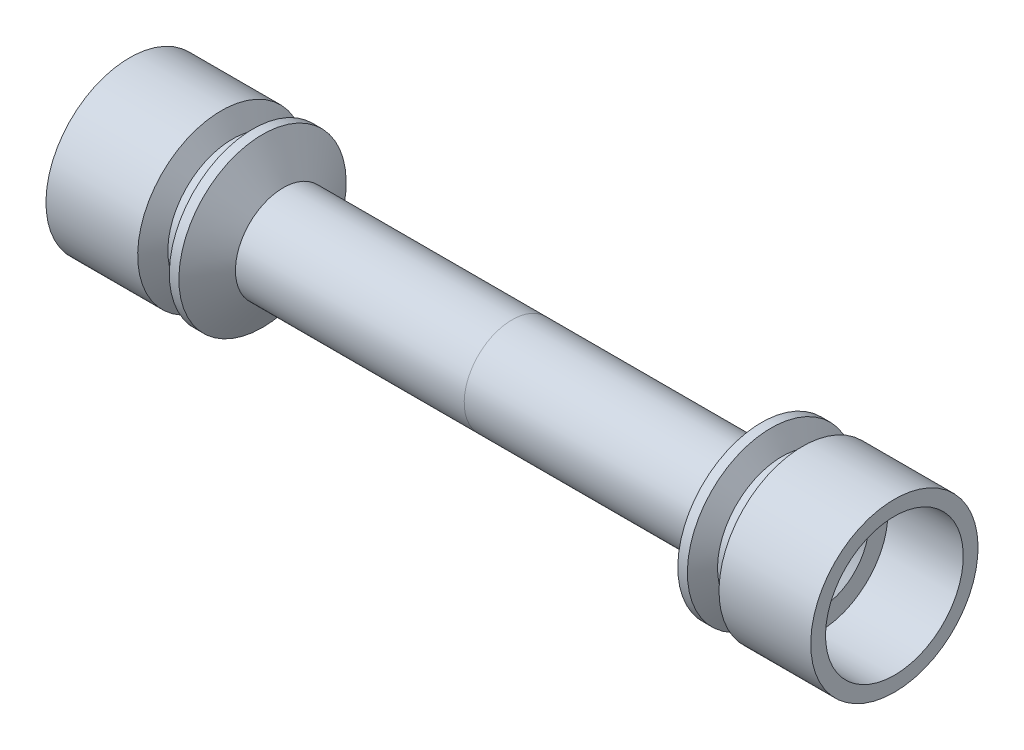
from build123d import *

# Parameters (mm, degrees)
CHAMFER1_SIZE = 0.508


with BuildPart() as part:
    # Sketch2 → Revolve1 (revolve)
    with BuildSketch(Plane.XY, mode=Mode.PRIVATE) as revolve1_sk:
        Polygon((-19.306984842, 5.55625), (-25.4, 5.55625), (-25.4, 4.575), (-20.4, 4.575), (-20.4, 3.305), (-19.892, 2.797), (-19.892, 1.7145), (-15.575, 1.7145), (-15.575, 0), (-14.1, 0), (-12.5, 1.6), (0, 1.6), (0, 3.175), (-15.19569983, 3.175), (-16.570515158, 5.55625), (-17.205515158, 5.55625), (-17.93875, 4.28625), (-18.57375, 4.28625), align=None)
    revolve(revolve1_sk.sketch.rotate(Axis((-25.4, 0, 0), (1, 0, 0)), 180), axis=Axis((-25.4, 0, 0), (1, 0, 0)))


with BuildPart() as body_2:
    # Mirror1: mirrored copy
    add(part.part.mirror(Plane(origin=(0, 0, 0), x_dir=(0, 0, 1), z_dir=(1, 0, 0))))


with BuildPart() as part_1:
    add(part.part)

    # Chamfer1
    chamfer1_edges = [part_1.edges().sort_by_distance(p)[0] for p in [
        (-25.4, 4.575, 0),
    ]]
    chamfer(chamfer1_edges, length=CHAMFER1_SIZE)


solid = Compound([body_2.part, part_1.part])
